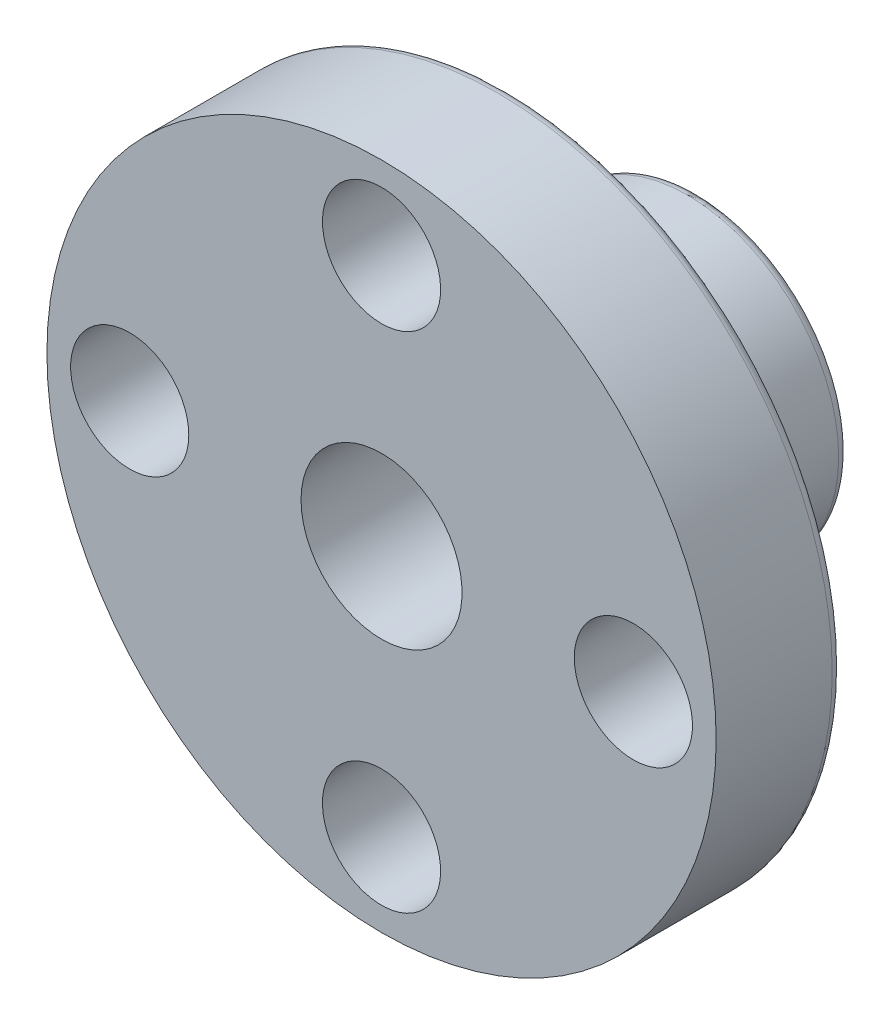
from build123d import *

# Parameters (mm, degrees)
SKETCH1_R           = 80.562529646
BOSS_EXTRUDE1_DEPTH = 30.48
SKETCH3_R           = 36.406797413
BOSS_EXTRUDE2_DEPTH = 45.72
SKETCH4_R           = 19.383893348
CUT_EXTRUDE1_DEPTH  = 138.065978148
SKETCH5_R           = 14.222468522
CUT_EXTRUDE2_DEPTH  = 122.840694211
CIRPATTERN2_COUNT   = 4
FILLET1_R           = 2.54
FILLET2_R           = 2.54


with BuildPart() as part:
    # Sketch1 → Boss-Extrude1 (new body)
    with BuildSketch(Plane.XY):
        with Locations(Location((0, 0, 0), (0, 0, 180))):
            Circle(SKETCH1_R)
    extrude(amount=BOSS_EXTRUDE1_DEPTH)

    # Sketch3 → Boss-Extrude2 (add)
    with BuildSketch(Plane(origin=(0, 0, 0), x_dir=(-1, 0, 0), z_dir=(0, 0, -1))):
        with Locations(Location((0, 0, 0), (0, 0, 180))):
            Circle(SKETCH3_R)
    extrude(amount=BOSS_EXTRUDE2_DEPTH)

    # Sketch4 → Cut-Extrude1 (cut, through all)
    with BuildSketch(Plane(origin=(0, 0, -45.72), x_dir=(-1, 0, 0), z_dir=(0, 0, -1))):
        Circle(SKETCH4_R)
    extrude(amount=-CUT_EXTRUDE1_DEPTH, mode=Mode.SUBTRACT)

    # Sketch5 → Cut-Extrude2 (cut, through all)
    with BuildSketch(Plane(origin=(0, 0, -2.54), x_dir=(-1, 0, 0), z_dir=(0, 0, -1))):
        with Locations((-60.632628963, 0)):
            Circle(SKETCH5_R)
    cut_extrude2 = extrude(amount=-CUT_EXTRUDE2_DEPTH, mode=Mode.SUBTRACT)

    # CirPattern2: Cut-Extrude2 ×4 about axis
    cirpattern2_axis = Axis((0, 0, 0), (0, 0, 1))
    for i in range(1, CIRPATTERN2_COUNT):
        add(cut_extrude2.rotate(cirpattern2_axis, i * 360 / CIRPATTERN2_COUNT), mode=Mode.SUBTRACT)

    # Fillet1
    fillet1_edges = [part.edges().sort_by_distance(p)[0] for p in [
        (-36.406797413, 0, 0),
        (-36.406797413, 0, -45.72),
    ]]
    fillet(fillet1_edges, radius=FILLET1_R)

    # Fillet2
    fillet2_edges = [part.edges().sort_by_distance(p)[0] for p in [
        (80.562529646, 0, 0),
    ]]
    fillet(fillet2_edges, radius=FILLET2_R)


solid = part.part
